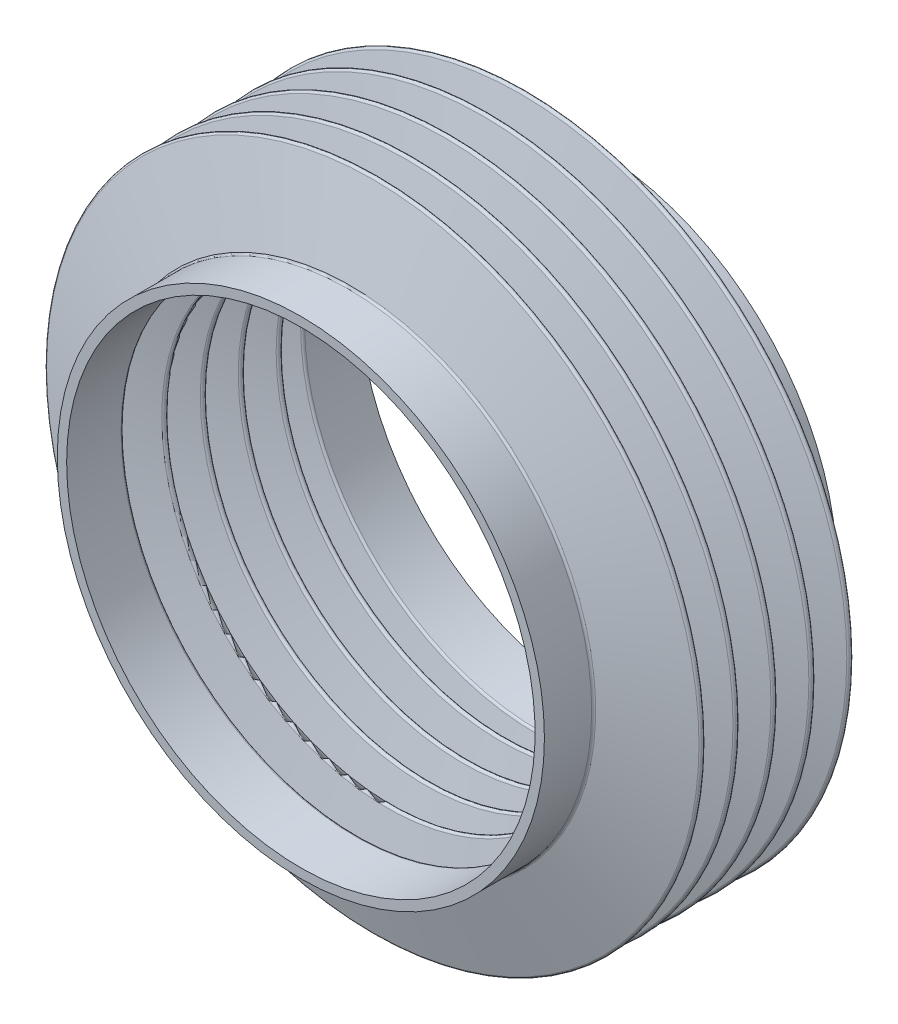
from build123d import *


with BuildPart() as part:
    # Sketch1 → Revolve1 (revolve)
    with BuildSketch(Plane(origin=(0, 0, 0), x_dir=(1, 0, 0), z_dir=(0, 1, 0))):
        with BuildLine():
            Line((-25, 31.21), (-25, 25.408645609))
            ThreePointArc((-25, 25.408645609), (-25.054266601, 25.253119288), (-25.193507492, 25.165112046))
            Line((-25.193507492, 25.165112046), (-30.477369148, 23.939414073))
            ThreePointArc((-30.477369148, 23.939414073), (-30.670872362, 23.697343193), (-30.480214932, 23.453024652))
            Line((-30.480214932, 23.453024652), (-24.019785068, 21.874512709))
            ThreePointArc((-24.019785068, 21.874512709), (-23.829127638, 21.630194169), (-24.022630852, 21.388123289))
            Line((-24.022630852, 21.388123289), (-30.477369148, 19.890816932))
            ThreePointArc((-30.477369148, 19.890816932), (-30.670872362, 19.648746052), (-30.480214932, 19.404427512))
            Line((-30.480214932, 19.404427512), (-24.019785068, 17.825915569))
            ThreePointArc((-24.019785068, 17.825915569), (-23.829127638, 17.581597029), (-24.022630852, 17.339526149))
            Line((-24.022630852, 17.339526149), (-30.477369148, 15.842219792))
            ThreePointArc((-30.477369148, 15.842219792), (-30.670872362, 15.600148912), (-30.480214932, 15.355830372))
            Line((-30.480214932, 15.355830372), (-24.019785068, 13.777318428))
            ThreePointArc((-24.019785068, 13.777318428), (-23.829127638, 13.532999888), (-24.022630852, 13.290929008))
            Line((-24.022630852, 13.290929008), (-30.477369148, 11.793622651))
            ThreePointArc((-30.477369148, 11.793622651), (-30.670872362, 11.551551771), (-30.480214932, 11.307233231))
            Line((-30.480214932, 11.307233231), (-24.099293796, 9.748148088))
            ThreePointArc((-24.099293796, 9.748148088), (-23.90869376, 9.499739514), (-24.110137758, 9.260040727))
            Line((-24.110137758, 9.260040727), (-30.464691369, 8.003535417))
            ThreePointArc((-30.464691369, 8.003535417), (-30.666022356, 7.767627964), (-30.482876208, 7.517340168))
            Line((-30.482876208, 7.517340168), (-25.183320832, 6.050732508))
            ThreePointArc((-25.183320832, 6.050732508), (-25.051040466, 5.961166119), (-25, 5.809788763))
            Line((-25, 5.809788763), (-25, 0))
            Line((-25, 0), (-26, 0))
            Line((-26, 0), (-26, 5.048943813))
            ThreePointArc((-26, 5.048943813), (-26.051040466, 5.200321169), (-26.183320832, 5.289887558))
            Line((-26.183320832, 5.289887558), (-34.818088048, 7.679487221))
            ThreePointArc((-34.818088048, 7.679487221), (-35.001234197, 7.929775017), (-34.79990321, 8.16568247))
            Line((-34.79990321, 8.16568247), (-28.744666106, 9.363003012))
            ThreePointArc((-28.744666106, 9.363003012), (-28.543222108, 9.6027018), (-28.733822144, 9.851110373))
            Line((-28.733822144, 9.851110373), (-34.79670837, 11.332488318))
            ThreePointArc((-34.79670837, 11.332488318), (-34.987365799, 11.576806858), (-34.793862586, 11.818877738))
            Line((-34.793862586, 11.818877738), (-28.33912429, 13.316184095))
            ThreePointArc((-28.33912429, 13.316184095), (-28.145621076, 13.558254975), (-28.336278506, 13.802573515))
            Line((-28.336278506, 13.802573515), (-34.79670837, 15.381085458))
            ThreePointArc((-34.79670837, 15.381085458), (-34.987365799, 15.625403999), (-34.793862586, 15.867474879))
            Line((-34.793862586, 15.867474879), (-28.33912429, 17.364781235))
            ThreePointArc((-28.33912429, 17.364781235), (-28.145621076, 17.606852116), (-28.336278506, 17.851170656))
            Line((-28.336278506, 17.851170656), (-34.79670837, 19.429682599))
            ThreePointArc((-34.79670837, 19.429682599), (-34.987365799, 19.674001139), (-34.793862586, 19.916072019))
            Line((-34.793862586, 19.916072019), (-28.33912429, 21.413378376))
            ThreePointArc((-28.33912429, 21.413378376), (-28.145621076, 21.655449256), (-28.336278506, 21.899767796))
            Line((-28.336278506, 21.899767796), (-34.79670837, 23.478279739))
            ThreePointArc((-34.79670837, 23.478279739), (-34.987365799, 23.72259828), (-34.793862586, 23.96466916))
            Line((-34.793862586, 23.96466916), (-26.193507492, 25.959694482))
            ThreePointArc((-26.193507492, 25.959694482), (-26.054266601, 26.047701725), (-26, 26.203228046))
            Line((-26, 26.203228046), (-26, 31.21))
            Line((-26, 31.21), (-25, 31.21))
        make_face()
    revolve(axis=Axis((0, 0, -81.437131039), (0, 0, 1)))


solid = part.part
